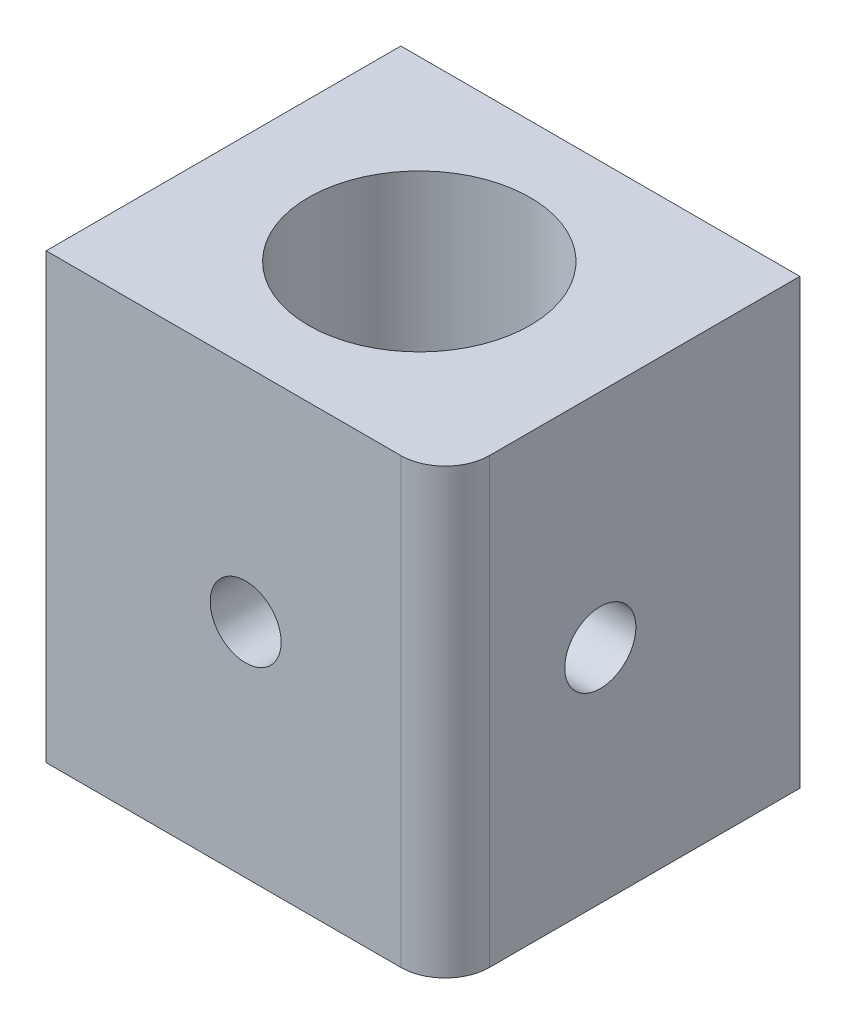
from build123d import *

# Parameters (mm, degrees)
SKETCH1_W           = 18
SKETCH1_H           = 16
SKETCH1_R           = 5
BOSS_EXTRUDE2_DEPTH = 20
SKETCH3_R           = 1.605
CUT_EXTRUDE1_DEPTH  = 10
SKETCH4_R           = 1.6
CUT_EXTRUDE2_DEPTH  = 10
FILLET1_R           = 2


with BuildPart() as part:
    # Sketch1 → Boss-Extrude2 (new body)
    with BuildSketch(Plane(origin=(0, 0, 0), x_dir=(1, 0, 0), z_dir=(0, 1, 0))):
        with Locations((-15.037129634, 3.2340174)):
            Rectangle(SKETCH1_W, SKETCH1_H)
        with Locations(Location((-15.204317972, 3.2340174, 0), (0, 0, 270))):
            Circle(SKETCH1_R, mode=Mode.SUBTRACT)
    extrude(amount=BOSS_EXTRUDE2_DEPTH)

    # Sketch3 → Cut-Extrude1 (cut)
    with BuildSketch(Plane(origin=(-6.037129634, 0, 0), x_dir=(0, 0, -1), z_dir=(1, 0, 0))):
        with Locations((2.2340174, 10)):
            Circle(SKETCH3_R)
    extrude(amount=-CUT_EXTRUDE1_DEPTH, mode=Mode.SUBTRACT)

    # Sketch4 → Cut-Extrude2 (cut)
    with BuildSketch(Plane.XY.offset(4.7659826)):
        with Locations((-15.037129634, 10)):
            Circle(SKETCH4_R)
    extrude(amount=-CUT_EXTRUDE2_DEPTH, mode=Mode.SUBTRACT)

    # Fillet1
    fillet1_edges = [part.edges().sort_by_distance(p)[0] for p in [
        (-6.037129634, 10, 4.7659826),
    ]]
    fillet(fillet1_edges, radius=FILLET1_R)


solid = part.part
